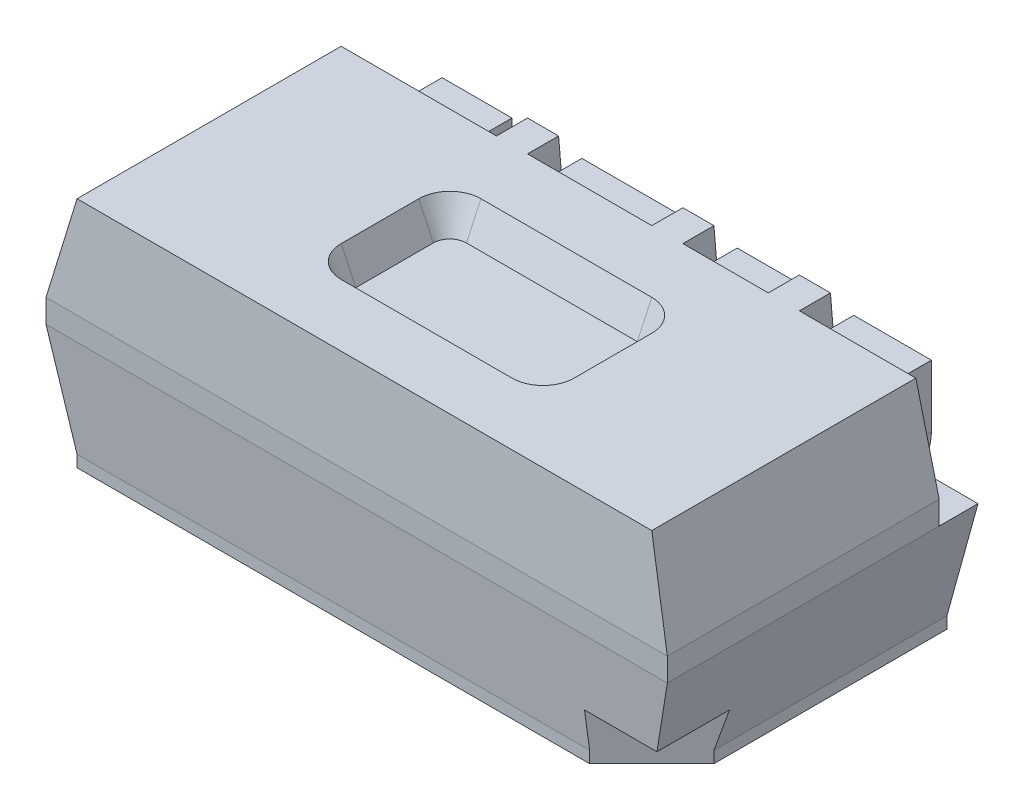
from build123d import *

# Parameters (mm, degrees)
EXTRUDE_1_DEPTH     = 2
SKETCH_2_OUTSIDE_W  = 6.944
SKETCH_2_OUTSIDE_H  = 4.444
CUT_EXTRUDE_1_DEPTH = 3.926174978
CUT_EXTRUDE_2_DEPTH = 0.3
SKETCH_6_W          = 0.6
SKETCH_6_H          = 0.15
SKETCH_6_W_2        = 0.45
SKETCH_6_W_3        = 0.35
SKETCH_6_W_4        = 0.5
SKETCH_5_W          = 0.8
SKETCH_5_H          = 0.25
SKETCH_5_W_2        = 1.15
SKETCH_5_W_3        = 0.55
SKETCH_5_W_4        = 0.9
CUT_EXTRUDE_4_DEPTH = 0.75
CUT_EXTRUDE_5_DEPTH = 0.2
CUT_EXTRUDE_5_DRAFT = -25
CUT_EXTRUDE_6_DEPTH = 0.01


with BuildPart() as part:
    # Эскиз1 → Бобышка-Вытянуть1 (new, symmetric)
    with BuildSketch(Plane(origin=(0, 0, 0), x_dir=(0, -1, 0), z_dir=(1, 0, 0))):
        Polygon((-0.15, -2), (0, -2), (0.675, -1.95), (0.75, -1.95), (0.75, -0.05), (0.675, -0.05), (0, 0), (-0.15, 0), (-0.75, -0.05), (-0.75, -1.95), align=None)
    extrude(amount=EXTRUDE_1_DEPTH, both=True)

    # Эскиз2 outside → Вырез-Вытянуть1 (cut, through all)
    with BuildSketch(Plane.XY):
        Rectangle(SKETCH_2_OUTSIDE_W, SKETCH_2_OUTSIDE_H)
        Polygon((2, 0), (1.85, -0.675), (1.85, -0.75), (-1.85, -0.75), (-1.85, -0.675), (-2, 0), (-2, 0.15), (-1.85, 0.75), (1.85, 0.75), (2, 0.15), align=None, mode=Mode.SUBTRACT)
    extrude(amount=CUT_EXTRUDE_1_DEPTH, mode=Mode.SUBTRACT)

    # Эскиз4 → Вырез-Вытянуть2 (cut)
    with BuildSketch(Plane.XZ.offset(0.75)):
        Polygon((2, 2), (2, 1.4), (1.4, 2), align=None)
    extrude(amount=-CUT_EXTRUDE_2_DEPTH, mode=Mode.SUBTRACT)

    # Эскиз5 → Вырез-Вытянуть4 (cut)
    with BuildSketch(Plane(origin=(0, 0.75, 0), x_dir=(1, 0, 0), z_dir=(0, 1, 0))):
        with Locations((-0.25, -0.125)):
            Rectangle(SKETCH_5_W, SKETCH_5_H)
        with Locations((-1.425, -0.125)):
            Rectangle(SKETCH_5_W_2, SKETCH_5_H)
        with Locations((0.625, -0.125)):
            Rectangle(SKETCH_5_W_3, SKETCH_5_H)
        with Locations((1.55, -0.125)):
            Rectangle(SKETCH_5_W_4, SKETCH_5_H)
    extrude(amount=-CUT_EXTRUDE_4_DEPTH, mode=Mode.SUBTRACT)


with BuildPart() as body_2:
    # По траектории3: sweep along a path in Эскиз7
    with BuildLine(Plane(origin=(0, 0, 0), x_dir=(0, 0, -1), z_dir=(1, 0, 0))) as sweep_3_path:
        Line((0, 0.65), (0, 0.25))
        ThreePointArc((0, 0.25), (-0.073223305, 0.073223305), (-0.25, 0))
    # Эскиз6 → По траектории3 (sweep)
    with BuildSketch(Plane(origin=(0, 0.65, 0), x_dir=(1, 0, 0), z_dir=(0, 1, 0))):
        with Locations((-0.25, -0.075)):
            Rectangle(SKETCH_6_W, SKETCH_6_H)
        with Locations((-1.225, -0.075)):
            Rectangle(SKETCH_6_W_2, SKETCH_6_H)
        with Locations((0.625, -0.075)):
            Rectangle(SKETCH_6_W_3, SKETCH_6_H)
        with Locations((1.45, -0.075)):
            Rectangle(SKETCH_6_W_4, SKETCH_6_H)
    sweep(path=sweep_3_path.line)


with BuildPart() as cut_extrude_5_tool:
    # Эскиз9 → Вырез-Вытянуть5 (with draft: the straight prism first)
    with BuildSketch(Plane(origin=(0, 0.75, 0), x_dir=(1, 0, 0), z_dir=(0, 1, 0))):
        with BuildLine():
            ThreePointArc((-0.55, -0.65), (-0.691421356, -0.708578644), (-0.75, -0.85))
            Line((-0.75, -0.85), (-0.75, -1.35))
            ThreePointArc((-0.75, -1.35), (-0.691421356, -1.491421356), (-0.55, -1.55))
            Line((-0.55, -1.55), (0.55, -1.55))
            ThreePointArc((0.55, -1.55), (0.691421356, -1.491421356), (0.75, -1.35))
            Line((0.75, -1.35), (0.75, -0.85))
            ThreePointArc((0.75, -0.85), (0.691421356, -0.708578644), (0.55, -0.65))
            Line((0.55, -0.65), (-0.55, -0.65))
        make_face()
    extrude(amount=-CUT_EXTRUDE_5_DEPTH)
    # Вырез-Вытянуть5: the draft: its side faces are tilted about the plane it starts from
    cut_extrude_5_sides = [cut_extrude_5_tool.faces().sort_by_distance(p)[0] for p in [
        (-0.691421356, 0.65, 0.708578644),
        (-0.75, 0.65, 1.1),
        (-0.691421356, 0.65, 1.491421356),
        (0, 0.65, 1.55),
        (0.691421356, 0.65, 1.491421356),
        (0.75, 0.65, 1.1),
        (0.691421356, 0.65, 0.708578644),
        (0, 0.65, 0.65),
    ]]
    draft(cut_extrude_5_sides, Plane(origin=(0, 0.75, 0), x_dir=(1, 0, 0), z_dir=(0, 1, 0)), CUT_EXTRUDE_5_DRAFT)


with BuildPart() as part_1:
    add(part.part)

    # Вырез-Вытянуть5: cut by cut_extrude_5_tool
    add(cut_extrude_5_tool.part, mode=Mode.SUBTRACT)

    # Эскиз10 → Вырез-Вытянуть6 (cut)
    with BuildSketch(Plane(origin=(0, -0.75, 0), x_dir=(-1, 0, 0), z_dir=(0, -1, 0))):
        Polygon((1.1, -1.8), (-1.1, -1.8), (-1.45, -1.45), (-1.45, -0.65), (-1.1, -0.3), (1.1, -0.3), (1.45, -0.65), (1.45, -1.45), align=None)
    extrude(amount=-CUT_EXTRUDE_6_DEPTH, mode=Mode.SUBTRACT)


solid = Compound([body_2.part, part_1.part])
